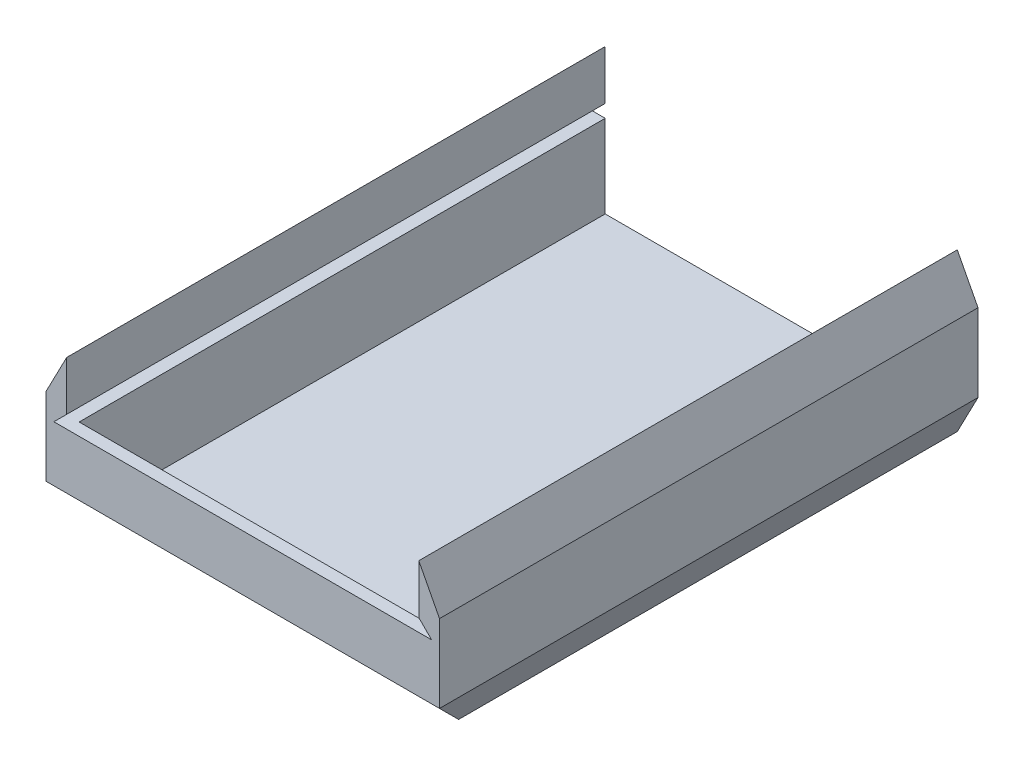
from build123d import *

# Parameters (mm, degrees)
SKETCH1_W                           = 85
SKETCH1_H                           = 130
BOSS_EXTRUDE1_BASE_DEPTH            = 3
BOSS_EXTRUDE4_SIDE_WALLS_DEPTH      = 130
CUT_EXTRUDE2_GUIDE_HOLES_DEPTH      = 163.616112363
SKETCH15_W                          = 85
SKETCH15_H                          = 20
BOSS_EXTRUDE9_FRONT_WALL_DEPTH      = 3
CHAMFER5_FRONT_CHAMFER_SIZE         = 9.61
CHAMFER6_FRONT_CHAMFER_CLEANUP_SIZE = 5


with BuildPart() as part:
    # Sketch1 → Boss-Extrude1 (Base) (new body)
    with BuildSketch(Plane(origin=(0, 0, 0), x_dir=(1, 0, 0), z_dir=(0, 1, 0))):
        with Locations((42.5, 65)):
            Rectangle(SKETCH1_W, SKETCH1_H)
    extrude(amount=BOSS_EXTRUDE1_BASE_DEPTH)

    # Sketch5 → Boss-Extrude4 (Side Walls) (add, through all)
    with BuildSketch(Plane.XY):
        Polygon((-5, 28.390936655), (0, 38), (0, 0), (-5, 9.609063345), align=None)
        Polygon((90, 9.609063345), (90, 28.390936655), (85, 38), (85, 0), align=None)
    extrude(amount=-BOSS_EXTRUDE4_SIDE_WALLS_DEPTH)

    # Sketch4 → Cut-Extrude2 (Guide Holes) (cut, through all)
    with BuildSketch(Plane.XY):
        Polygon((-3.1, 23), (0, 26.1), (0, 23), align=None)
        Polygon((85, 23), (88.1, 23), (85, 26.1), align=None)
    extrude(amount=-CUT_EXTRUDE2_GUIDE_HOLES_DEPTH, mode=Mode.SUBTRACT)

    # Sketch15 → Boss-Extrude9 (Front Wall) (add)
    with BuildSketch(Plane.XY):
        with Locations((42.5, 13)):
            Rectangle(SKETCH15_W, SKETCH15_H)
    extrude(amount=-BOSS_EXTRUDE9_FRONT_WALL_DEPTH)

    # Chamfer5 (Front Chamfer)
    chamfer5_front_chamfer_edges = [part.edges().sort_by_distance(p)[0] for p in [
        (42.5, 0, 0),
    ]]
    chamfer(chamfer5_front_chamfer_edges, length=CHAMFER5_FRONT_CHAMFER_SIZE)

    # Chamfer6 (Front Chamfer Cleanup)
    chamfer6_front_chamfer_cleanup_edges = [part.edges().sort_by_distance(p)[0] for p in [
        (42.5, 3, -3),
    ]]
    chamfer(chamfer6_front_chamfer_cleanup_edges, length=CHAMFER6_FRONT_CHAMFER_CLEANUP_SIZE)


solid = part.part
